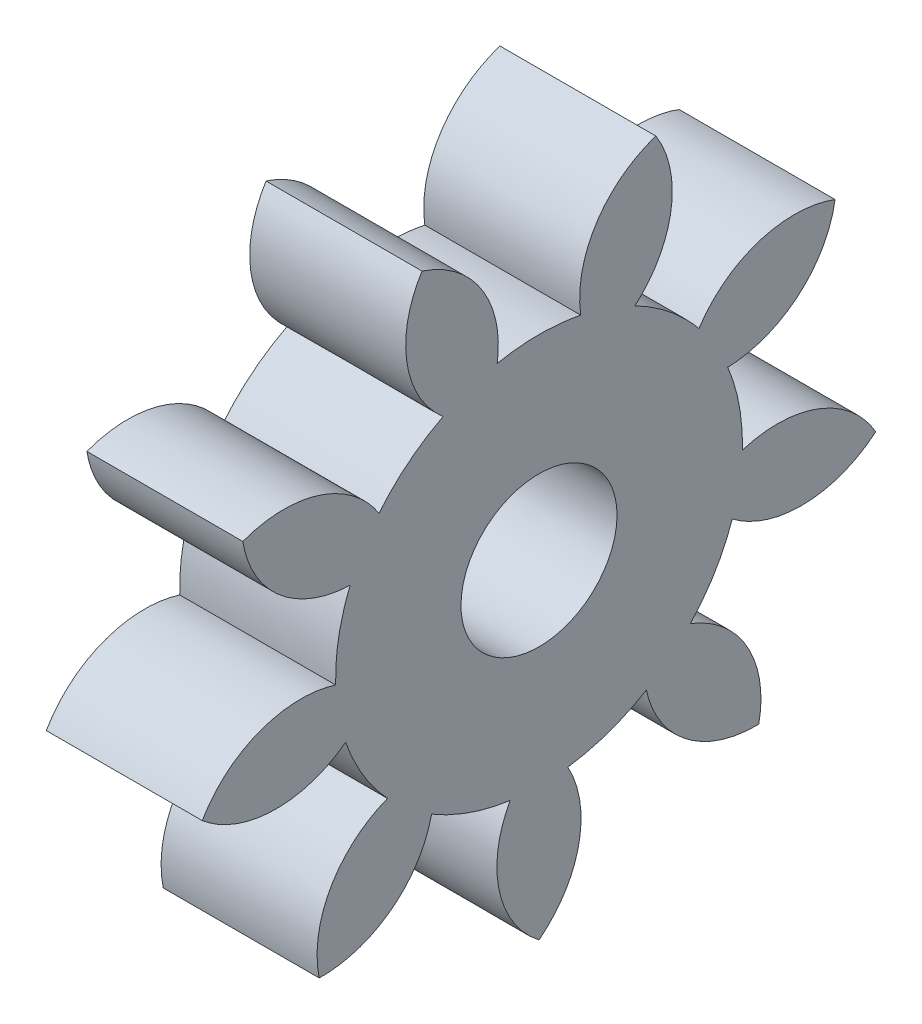
from build123d import *

# Parameters (mm, degrees)
BASPROSKE_W     = 3.175
BASPROSKE_H     = 6.985
TOOTHCUT_DEPTH  = 11.375985495
TEETHCUTS_COUNT = 9
BORSKE_R        = 1.5875
BORE_DEPTH      = 50.8000508
SCALE1_SCALE_X  = 1.3
SCALE1_SCALE_Y  = 1.25
SCALE1_SCALE_Z  = 1.3


with BuildPart() as part:
    # BasProSke → Base-Revolve (revolve)
    with BuildSketch(Plane(origin=(0, 0, 0), x_dir=(1, 0, 0), z_dir=(0, 1, 0)), mode=Mode.PRIVATE) as base_revolve_sk:
        with Locations((1.5875, 3.4925)):
            Rectangle(BASPROSKE_W, BASPROSKE_H)
    revolve(base_revolve_sk.sketch.rotate(Axis((-10, 0, 0), (1, 0, 0)), 180), axis=Axis((-10, 0, 0), (1, 0, 0)))

    # TooCutSke → ToothCut (cut, through all)
    with BuildSketch(Plane(origin=(0, 0, 0), x_dir=(0, 0, -1), z_dir=(1, 0, 0))):
        with BuildLine():
            ThreePointArc((0.85090004, 4.051817513), (0, 4.1402), (-0.85090004, 4.051817513))
            ThreePointArc((-0.85090004, 4.051817513), (-1.187930048, 5.606894235), (-2.458065659, 6.565334826))
            ThreePointArc((-2.458065659, 6.565334826), (0, 7.0104), (2.458065659, 6.565334826))
            ThreePointArc((2.458065659, 6.565334826), (1.187930048, 5.606894235), (0.85090004, 4.051817513))
        make_face()
    toothcut = extrude(amount=TOOTHCUT_DEPTH, mode=Mode.SUBTRACT)

    # TeethCuts: ToothCut ×9 about axis
    teethcuts_axis = Axis((-10, 0, 0), (1, 0, 0))
    for i in range(1, TEETHCUTS_COUNT):
        add(toothcut.rotate(teethcuts_axis, i * 360 / TEETHCUTS_COUNT), mode=Mode.SUBTRACT)

    # BorSke → Bore (cut, symmetric)
    with BuildSketch(Plane(origin=(0, 0, 0), x_dir=(0, 0, -1), z_dir=(1, 0, 0))):
        with Locations(Location((0, 0, 0), (0, 0, 180))):
            Circle(BORSKE_R)
    extrude(amount=BORE_DEPTH, both=True, mode=Mode.SUBTRACT)


with BuildPart() as part_1:
    # Scale1: scaled about (1.5875, 0, 0)
    add(part.part.scale((SCALE1_SCALE_X, SCALE1_SCALE_Y, SCALE1_SCALE_Z), about=(1.5875, 0, 0)))


solid = part_1.part
